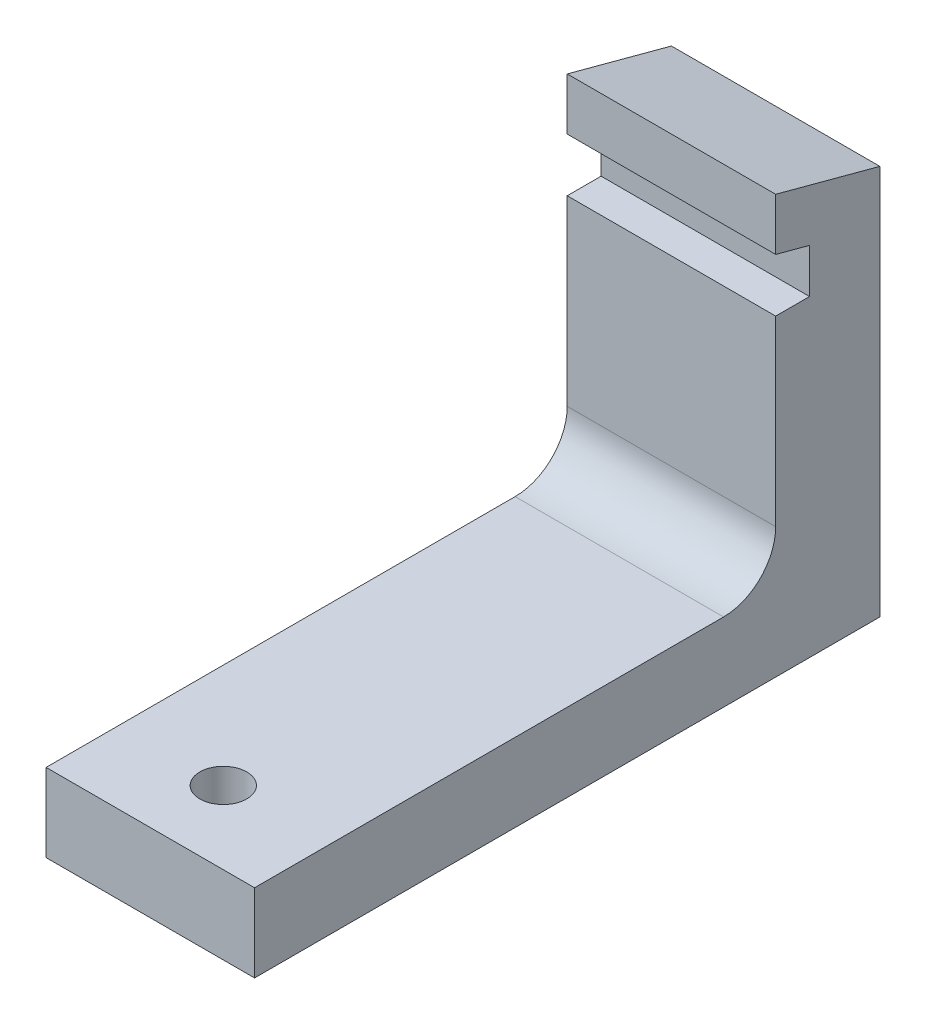
from build123d import *

# Parameters (mm, degrees)
BOSS_EXTRUDE1_DEPTH = 4
FILLET1_R           = 2
SKETCH2_R           = 0.9
CUT_EXTRUDE1_DEPTH  = 4


with BuildPart() as part:
    # Sketch1 → Boss-Extrude1 (new, symmetric)
    with BuildSketch(Plane(origin=(0, 0, 0), x_dir=(0, 0, -1), z_dir=(1, 0, 0))):
        Polygon((0, 3), (20, 3), (20, 12), (21.3, 12), (21.3, 13.7), (20, 14.04833395), (20, 16.04833395), (24, 14.97653718), (24, 0), (0, 0), align=None)
    extrude(amount=BOSS_EXTRUDE1_DEPTH, both=True)

    # Fillet1
    fillet1_edges = [part.edges().sort_by_distance(p)[0] for p in [
        (0, 3, -20),
    ]]
    fillet(fillet1_edges, radius=FILLET1_R)

    # Sketch2 → Cut-Extrude1 (cut)
    with BuildSketch(Plane.XZ):
        with Locations((0, -20.8)):
            Circle(SKETCH2_R)
        with Locations((0, -2.8)):
            Circle(SKETCH2_R)
    extrude(amount=-CUT_EXTRUDE1_DEPTH, mode=Mode.SUBTRACT)


solid = part.part
